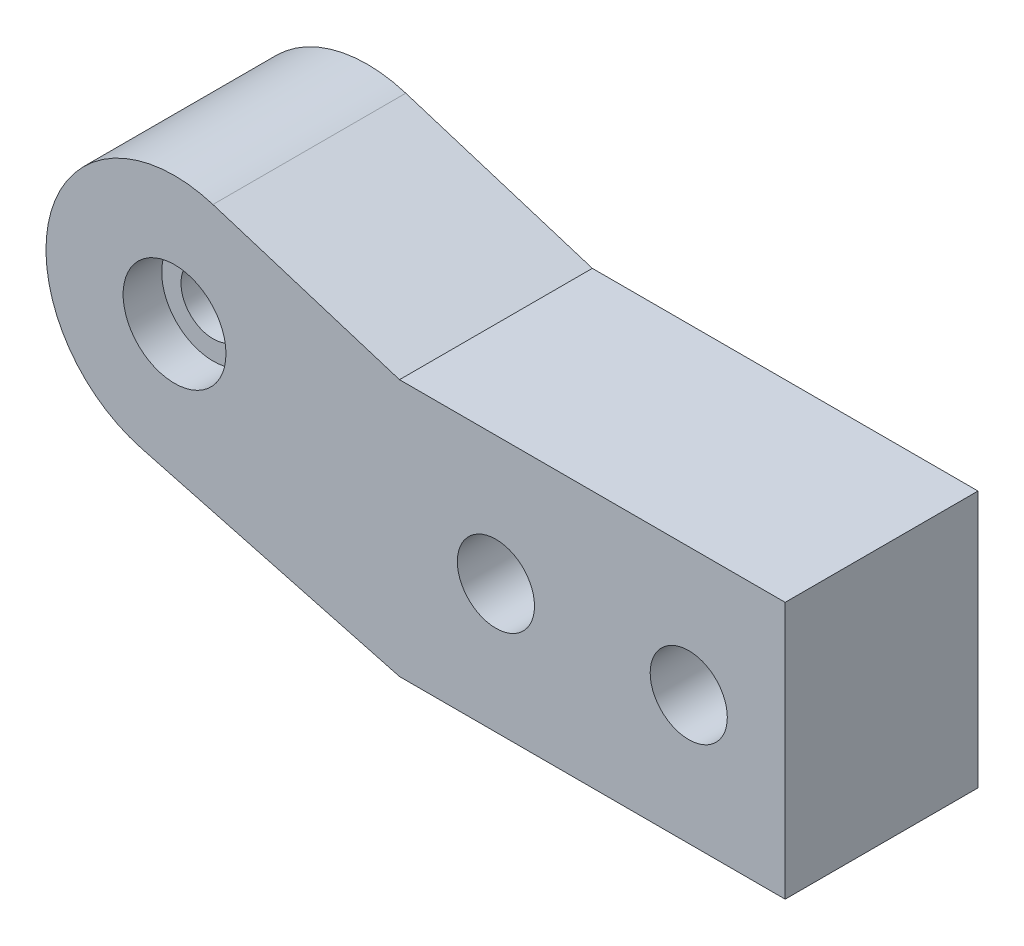
from build123d import *

# Parameters (mm, degrees)
SKETCH_1_R          = 3
EXTRUDE_1_DEPTH     = 15
SKETCH_4_R          = 5
CUT_EXTRUDE_3_DEPTH = 6
SKETCH_8_R          = 4
CUT_EXTRUDE_4_DEPTH = 3
SKETCH_10_R         = 2.5
CUT_EXTRUDE_5_DEPTH = 10


with BuildPart() as part:
    # 草图1 → 凸台-拉伸1 (new body)
    with BuildSketch(Plane.XY):
        with BuildLine():
            Line((-30, 0), (0, 0))
            Line((0, 0), (0, -20))
            Line((0, -20), (-30, -20))
            Line((-30, -20), (-50.06938155, -14.664278475))
            ThreePointArc((-50.06938155, -14.664278475), (-57.106051537, -2.220832162), (-44.512363219, 4.543271266))
            Line((-44.512363219, 4.543271266), (-30, 0))
        make_face()
        with Locations((-22.5, -10)):
            Circle(SKETCH_1_R, mode=Mode.SUBTRACT)
        with Locations((-7.5, -10)):
            Circle(SKETCH_1_R, mode=Mode.SUBTRACT)
    extrude(amount=EXTRUDE_1_DEPTH)

    # 草图4 → 切除-拉伸3 (cut)
    with BuildSketch(Plane(origin=(0, 0, 0), x_dir=(-1, 0, 0), z_dir=(0, 0, -1))):
        with Locations((7.5, -10)):
            Circle(SKETCH_4_R)
        with Locations((22.5, -10)):
            Circle(SKETCH_4_R)
    extrude(amount=-CUT_EXTRUDE_3_DEPTH, mode=Mode.SUBTRACT)

    # 草图8 → 切除-拉伸4 (cut)
    with BuildSketch(Plane.XY.offset(15)):
        with Locations((-47.5, -5)):
            Circle(SKETCH_8_R)
    extrude(amount=-CUT_EXTRUDE_4_DEPTH, mode=Mode.SUBTRACT)

    # 草图10 → 切除-拉伸5 (cut)
    with BuildSketch(Plane.XY.offset(12)):
        with Locations((-47.5, -5)):
            Circle(SKETCH_10_R)
    extrude(amount=-CUT_EXTRUDE_5_DEPTH, mode=Mode.SUBTRACT)


solid = part.part
